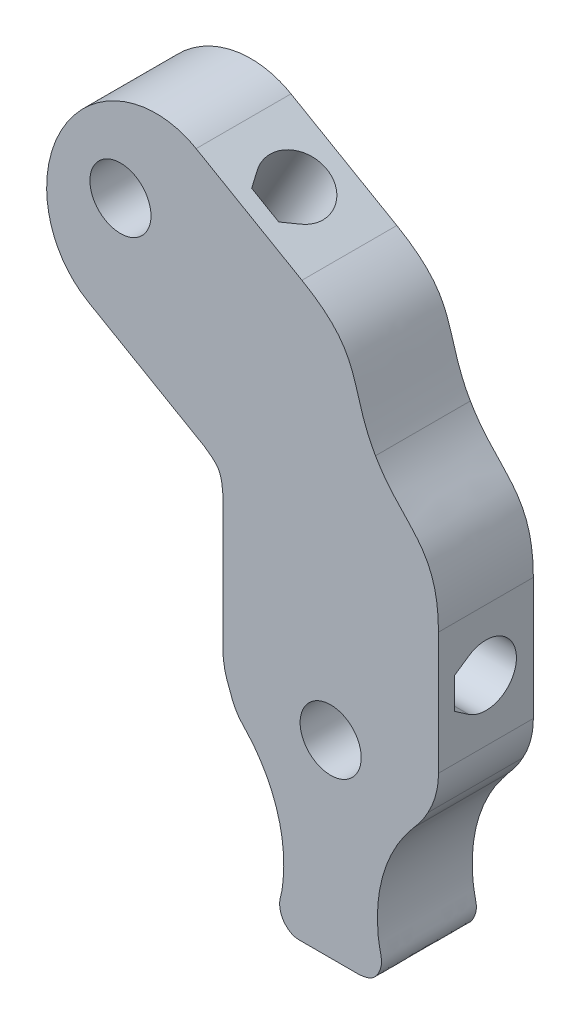
from build123d import *

# Parameters (mm, degrees)
SCHIZZO1_R                   = 4.25
ESTRUSIONE_ESTRUSIONE1_DEPTH = 6.6
TAGLIO_ESTRUSIONE1_REACH     = 71.721
TAGLIO_ESTRUSIONE2_REACH     = 75.377
ESTRUSIONE_ESTRUSIONE2_DEPTH = 13.2


with BuildPart() as part:
    # Schizzo1 → Estrusione-Estrusione1 (new, symmetric)
    with BuildSketch(Plane.XY):
        with BuildLine():
            Line((-15, -13.274990748), (-15, -30.274990748))
            add(Edge.make_bspline(
                [(-15, -30.274990748), (-15, -42.955990748), (0, -42.955990748), (15, -42.955990748), (15, -30.274990748)],
                knots=[3.141592654, 3.141592654, 3.141592654, 4.71238898, 4.71238898, 6.283185307, 6.283185307, 6.283185307], degree=2, weights=[1, 0.707106781, 1, 0.707106781, 1]))
            Line((15, -30.274990748), (15, -13.274990748))
            add(Edge.make_bspline(
                [(15, -13.274990748), (15, -3.027964059), (10.106357097, -3.104514731), (6.235473511, 3.60005231)],
                knots=[0, 0, 0, 0, 1, 1, 1, 1], degree=3))
            add(Edge.make_bspline(
                [(-3.996479222, 19.627876431), (4.877706203, 14.504363086), (2.364589925, 10.304619352), (6.235473511, 3.60005231)],
                knots=[0, 0, 0, 0, 1, 1, 1, 1], degree=3))
            Line((-3.996479222, 19.627876431), (-18.718911087, 28.127876431))
            add(Edge.make_bspline(
                [(-18.718911087, 28.127876431), (-29.700979232, 34.468376431), (-37.200979232, 21.477995374), (-44.700979232, 8.487614317), (-33.718911087, 2.147114317)],
                knots=[0, 0, 0, 1.570796327, 1.570796327, 3.141592654, 3.141592654, 3.141592654], degree=2, weights=[1, 0.707106781, 1, 0.707106781, 1]))
            Line((-33.718911087, 2.147114317), (-18.996479222, -6.352885683))
            add(Edge.make_bspline(
                [(-18.996479222, -6.352885683), (-16.899001514, -7.438400962), (-15.916098989, -8.408807517), (-15.578194705, -8.994074906)],
                knots=[0, 0, 0, 0, 1, 1, 1, 1], degree=3))
            add(Edge.make_bspline(
                [(-15, -13.274990748), (-14.891344954, -10.915764128), (-15.24029042, -9.579342295), (-15.578194705, -8.994074906)],
                knots=[0, 0, 0, 0, 1, 1, 1, 1], degree=3))
        make_face()
        with Locations((0, -33.774990748)):
            Circle(SCHIZZO1_R, mode=Mode.SUBTRACT)
        with Locations((-29.25, 16.887495374)):
            Circle(SCHIZZO1_R, mode=Mode.SUBTRACT)
    extrude(amount=ESTRUSIONE_ESTRUSIONE1_DEPTH, both=True)

    # Schizzo11 → Taglio-Estrusione1 (cut, up to next)
    with BuildSketch(Plane(origin=(15, 0, 0), x_dir=(0, 0, -1), z_dir=(1, 0, 0)), mode=Mode.PRIVATE) as taglio_estrusione1_sk1:
        with BuildLine():
            Line((-4.35, -23.949990748), (-4.35, -19.599990748))
            Line((-4.35, -19.599990748), (-2.39780105, -18.265995147))
            ThreePointArc((-2.39780105, -18.265995147), (4.25, -21.774990748), (-2.39780105, -25.283986348))
            Line((-2.39780105, -25.283986348), (-4.35, -23.949990748))
        make_face()
    taglio_estrusione1_tool1 = extrude(taglio_estrusione1_sk1.sketch, amount=-TAGLIO_ESTRUSIONE1_REACH, mode=Mode.PRIVATE) & part.part
    add(taglio_estrusione1_tool1.solids().sort_by_distance((15, -21.774991, 0.13262))[0], mode=Mode.SUBTRACT)

    # Schizzo12 → Taglio-Estrusione2 (cut, up to next)
    with BuildSketch(Plane(origin=(7.5, 12.990381057, 0), x_dir=(0.8660254037844413, -0.49999999999999556, 0), z_dir=(0.49999999999999556, 0.8660254037844413, 0)), mode=Mode.PRIVATE) as taglio_estrusione2_sk1:
        with BuildLine():
            Line((-19.599990748, -4.35), (-23.949990748, -4.35))
            Line((-23.949990748, -4.35), (-25.283986348, -2.39780105))
            ThreePointArc((-25.283986348, -2.39780105), (-21.774990748, 4.25), (-18.265995147, -2.39780105))
            Line((-18.265995147, -2.39780105), (-19.599990748, -4.35))
        make_face()
    taglio_estrusione2_tool1 = extrude(taglio_estrusione2_sk1.sketch, amount=-TAGLIO_ESTRUSIONE2_REACH, mode=Mode.PRIVATE) & part.part
    add(taglio_estrusione2_tool1.solids().sort_by_distance((-11.357695, 23.877876, 0.13262))[0], mode=Mode.SUBTRACT)

    # Schizzo13 → Estrusione-Estrusione2 (add)
    with BuildSketch(Plane(origin=(0, 0, -6.6), x_dir=(-1, 0, 0), z_dir=(0, 0, -1))):
        with BuildLine():
            Line((-15, -30.274990748), (0, -39.867718542))
            Line((0, -39.867718542), (15, -30.274990748))
            add(Edge.make_bspline(
                [(15, -30.274990748), (14.286552343, -35.642674563), (12.565506585, -37.655510193)],
                knots=[0, 0, 0, 1, 1, 1], degree=2))
            add(Edge.make_bspline(
                [(4.10506744, -60.055622157), (4.459740121, -60.058634213), (5.309735163, -60.036763968), (6.710864815, -58.988006488), (7.147854358, -57.520473785), (7.072351228, -56.512862722), (6.770035967, -55.505403966), (6.60636226, -54.016011573), (6.486557139, -52.026305349), (6.590668201, -50.030330736), (6.888193387, -48.056017735), (7.381530805, -46.120444324), (8.063009774, -44.243476677), (8.92957941, -42.443375006), (9.977366286, -40.745610205), (11.01409433, -39.321978883), (11.964682186, -38.369644075), (12.406338677, -37.853253615), (12.565506585, -37.655510193)],
                knots=[0, 0, 0, 0, 0.027659547, 0.083336738, 0.139000984, 0.159159574, 0.173630483, 0.233516851, 0.293375319, 0.353233787, 0.413120141, 0.47298465, 0.532856344, 0.592727518, 0.652578769, 0.712466068, 0.750774856, 0.773630262, 0.773630262, 0.773630262, 0.773630262], degree=3))
            Line((4.10506744, -60.055622157), (-4.021762125, -60.055622157))
            add(Edge.make_bspline(
                [(-11.550033656, -38.550632907), (-11.221841828, -38.915098881), (-10.905955393, -39.400324728), (-9.693149697, -40.980983682), (-8.667280726, -42.740319033), (-7.676619274, -45.075200558), (-7.088981588, -46.982523744), (-6.693619494, -48.94007025), (-6.492445247, -50.927900736), (-6.504576025, -52.922668454), (-6.644083638, -54.747020658), (-6.998680259, -56.086180971), (-7.149359111, -57.415497232), (-6.581691337, -58.921504764), (-5.569896774, -59.859720696), (-4.067785317, -60.06211997), (-4.021762125, -60.055622157)],
                knots=[0.416114245, 0.416114245, 0.416114245, 0.416114245, 0.453646757, 0.468506229, 0.553584024, 0.600937777, 0.648267117, 0.695592694, 0.742926149, 0.790263012, 0.837596467, 0.872691441, 0.888628807, 0.932636917, 0.976655261, 1, 1, 1, 1], degree=3))
            add(Edge.make_bspline(
                [(-15, -30.274990748), (-14.719890789, -35.092085056), (-11.550033656, -38.550632907)],
                knots=[0, 0, 0, 1, 1, 1], degree=2))
        make_face()
    extrude(amount=-ESTRUSIONE_ESTRUSIONE2_DEPTH)


solid = part.part
